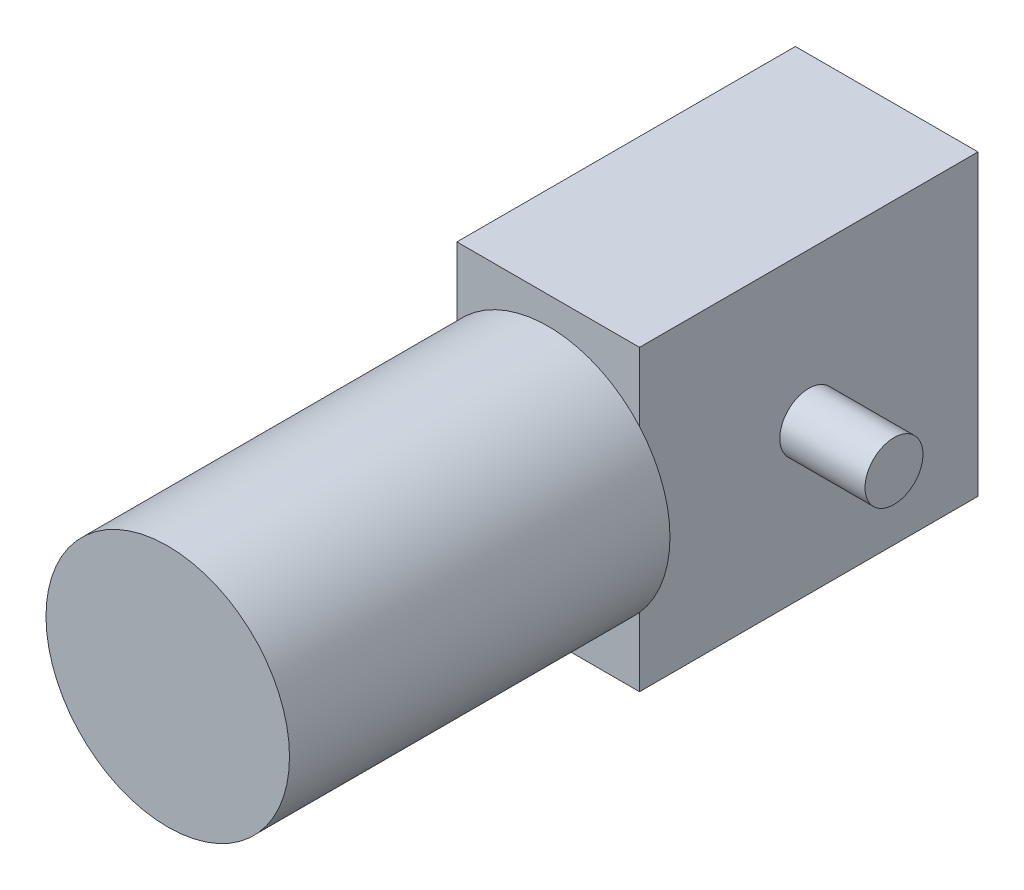
from build123d import *

# Parameters (mm, degrees)
CROQUIS1_W              = 120
CROQUIS1_H              = 196
SALIENTE_EXTRUIR1_DEPTH = 111.2
CROQUIS2_R              = 19.05
SALIENTE_EXTRUIR2_DEPTH = 116
CROQUIS3_R              = 80
SALIENTE_EXTRUIR3_DEPTH = 250


with BuildPart() as part:
    # Croquis1 → Saliente-Extruir1 (new, symmetric)
    with BuildSketch(Plane.XY):
        Rectangle(CROQUIS1_W, CROQUIS1_H)
    extrude(amount=SALIENTE_EXTRUIR1_DEPTH, both=True)

    # Croquis3 → Saliente-Extruir3 (add)
    with BuildSketch(Plane.XY.offset(111.2)):
        with Locations(Location((0, 0, 0), (0, 0, 138.590377891))):
            Circle(CROQUIS3_R)
    extrude(amount=SALIENTE_EXTRUIR3_DEPTH)


with BuildPart() as body_2:
    # Croquis2 → Saliente-Extruir2 (new, symmetric)
    with BuildSketch(Plane(origin=(0, 0, 0), x_dir=(0, 0, -1), z_dir=(1, 0, 0))):
        with Locations(Location((0, 0, 0), (0, 0, 180))):
            Circle(CROQUIS2_R)
    extrude(amount=SALIENTE_EXTRUIR2_DEPTH, both=True)


solid = Compound([part.part, body_2.part])
